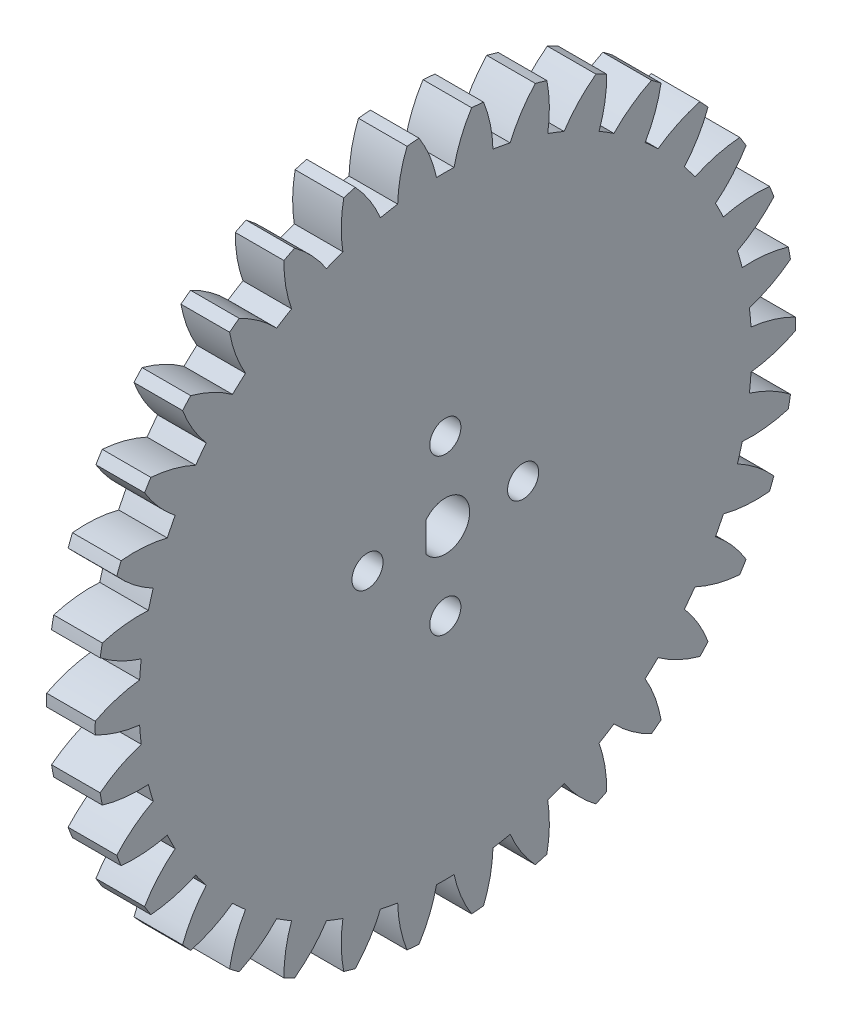
from build123d import *

# Parameters (mm, degrees)
BASPROSKE_W              = 5
BASPROSKE_H              = 36
TOOTHCUT_DEPTH           = 52.15662225
TEETHCUTS_COUNT          = 34
TEETHCUTS_ANGLE          = 349.411764706
BORSKE_R                 = 0.4
BORE_DEPTH               = 50.0000508
TAGLIO_ESTRUSIONE1_DEPTH = 10
SCHIZZO2_R               = 1.6
TAGLIO_ESTRUSIONE2_DEPTH = 10


with BuildPart() as part:
    # BasProSke → Base-Revolve (revolve)
    with BuildSketch(Plane(origin=(0, 0, 0), x_dir=(1, 0, 0), z_dir=(0, 1, 0)), mode=Mode.PRIVATE) as base_revolve_sk:
        with Locations((2.5, 18)):
            Rectangle(BASPROSKE_W, BASPROSKE_H)
    revolve(base_revolve_sk.sketch.rotate(Axis((-10, 0, 0), (1, 0, 0)), 180), axis=Axis((-10, 0, 0), (1, 0, 0)))

    # TooCutSke → ToothCut (cut, through all)
    with BuildSketch(Plane(origin=(0, 0, 0), x_dir=(0, 0, -1), z_dir=(1, 0, 0))):
        with BuildLine():
            ThreePointArc((0.901915747, 31.486085006), (0, 31.499), (-0.901915747, 31.486085006))
            ThreePointArc((-0.901915747, 31.486085006), (-1.615082782, 33.78510684), (-2.722392076, 35.922388931))
            ThreePointArc((-2.722392076, 35.922388931), (0, 36.0254), (2.722392076, 35.922388931))
            ThreePointArc((2.722392076, 35.922388931), (1.615082782, 33.78510684), (0.901915747, 31.486085006))
        make_face()
    toothcut = extrude(amount=TOOTHCUT_DEPTH, mode=Mode.SUBTRACT)

    # TeethCuts: ToothCut ×34 about axis
    teethcuts_axis = Axis((-10, 0, 0), (1, 0, 0))
    for i in range(1, TEETHCUTS_COUNT):
        add(toothcut.rotate(teethcuts_axis, i * TEETHCUTS_ANGLE / (TEETHCUTS_COUNT - 1)), mode=Mode.SUBTRACT)

    # BorSke → Bore (cut, symmetric)
    with BuildSketch(Plane(origin=(0, 0, 0), x_dir=(0, 0, -1), z_dir=(1, 0, 0))):
        with Locations(Location((0, 0, 0), (0, 0, 180))):
            Circle(BORSKE_R)
    extrude(amount=BORE_DEPTH, both=True, mode=Mode.SUBTRACT)

    # Schizzo1 → Taglio-Estrusione1 (cut)
    with BuildSketch(Plane(origin=(5, 0, 0), x_dir=(0, 0, -1), z_dir=(1, 0, 0))):
        with BuildLine():
            Line((-2, 1.5), (-2, -1.5))
            ThreePointArc((-2, -1.5), (2.5, 0), (-2, 1.5))
        make_face()
    extrude(amount=-TAGLIO_ESTRUSIONE1_DEPTH, mode=Mode.SUBTRACT)

    # Schizzo2 → Taglio-Estrusione2 (cut)
    with BuildSketch(Plane(origin=(5, 0, 0), x_dir=(0, 0, -1), z_dir=(1, 0, 0))):
        with Locations((0, 8)):
            Circle(SCHIZZO2_R)
        with Locations((8, 0)):
            Circle(SCHIZZO2_R)
        with Locations((0, -8)):
            Circle(SCHIZZO2_R)
        with Locations((-8, 0)):
            Circle(SCHIZZO2_R)
    extrude(amount=-TAGLIO_ESTRUSIONE2_DEPTH, mode=Mode.SUBTRACT)


solid = part.part
